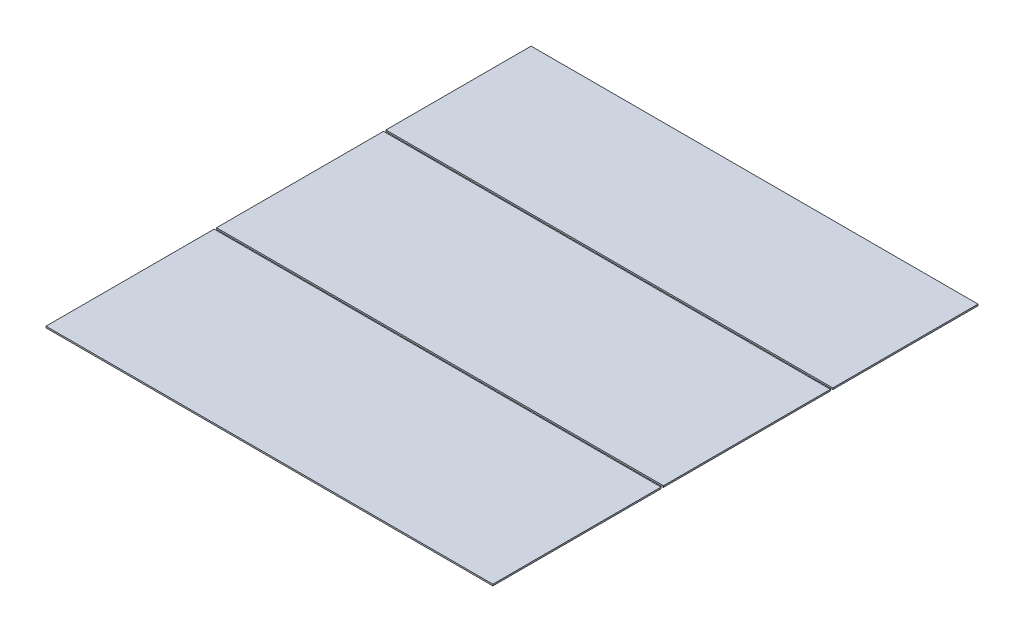
from build123d import *

# Parameters (mm, degrees)
BOSS_EXTRUDE1_DEPTH             = 2.5
BOSS_EXTRUDE1_DEPTH_BACK        = 2.5
SKETCH1_W                       = 1473.2
SKETCH1_H                       = 470.568
BOSS_EXTRUDE1_2_DEPTH           = 2.5
BOSS_EXTRUDE1_2_DEPTH_BACK      = 2.5
SKETCH1_H_2                     = 546.768
BOSS_EXTRUDE1_3_DEPTH           = 2.5
BOSS_EXTRUDE1_3_DEPTH_BACK      = 2.5
SKETCH1_H_3                     = 542.864
BOSS_EXTRUDE2_REACH             = 1089.541
SKETCH2_W                       = 1485.2
SKETCH2_H                       = 482.568
SKETCH2_W_2                     = 1473.2
SKETCH2_H_2                     = 470.568
SKETCH2_H_3                     = 558.768
SKETCH2_H_4                     = 546.768
SKETCH2_H_5                     = 554.864
SKETCH2_H_6                     = 542.864
BOSS_EXTRUDE2_DIRECTION_2_REACH = 1089.541


with BuildPart() as part:
    # Sketch1 → Boss-Extrude1 (new, two sides: drawn at the far end of the back side and taken through both)
    with BuildSketch(Plane(origin=(0, 0, 0), x_dir=(1, 0, 0), z_dir=(0, 1, 0)).offset(-BOSS_EXTRUDE1_DEPTH_BACK)):
        with Locations((0, 564.816)):
            Rectangle(SKETCH1_W, SKETCH1_H)
    extrude(amount=BOSS_EXTRUDE1_DEPTH + BOSS_EXTRUDE1_DEPTH_BACK)

    # Boss-Extrude2: up to this face of the body (flat: up to its plane)
    boss_extrude2_end = Plane(part.part.faces().sort_by_distance((0, 2.5, -564.816))[0])
    # Sketch2 → Boss-Extrude2 (add, up to the picked face)
    with BuildSketch(Plane(origin=(0, 0, 0), x_dir=(1, 0, 0), z_dir=(0, 1, 0)), mode=Mode.PRIVATE) as boss_extrude2_sk1:
        with Locations((0, 564.816)):
            Rectangle(SKETCH2_W, SKETCH2_H)
        with Locations((0, 564.816)):
            Rectangle(SKETCH2_W_2, SKETCH2_H_2, mode=Mode.SUBTRACT)
    boss_extrude2_tool1 = split(extrude(boss_extrude2_sk1.sketch, amount=BOSS_EXTRUDE2_REACH, mode=Mode.PRIVATE), bisect_by=boss_extrude2_end, keep=Keep.BOTH, mode=Mode.PRIVATE)
    # Sketch2 → Boss-Extrude2 (add, up to the picked face)
    with BuildSketch(Plane(origin=(0, 0, 0), x_dir=(1, 0, 0), z_dir=(0, 1, 0)), mode=Mode.PRIVATE) as boss_extrude2_sk2:
        with Locations((0, -526.716)):
            Rectangle(SKETCH2_W, SKETCH2_H_3)
        with Locations((0, -526.716)):
            Rectangle(SKETCH2_W_2, SKETCH2_H_4, mode=Mode.SUBTRACT)
    boss_extrude2_tool2 = split(extrude(boss_extrude2_sk2.sketch, amount=BOSS_EXTRUDE2_REACH, mode=Mode.PRIVATE), bisect_by=boss_extrude2_end, keep=Keep.BOTH, mode=Mode.PRIVATE)
    # Sketch2 → Boss-Extrude2 (add, up to the picked face)
    with BuildSketch(Plane(origin=(0, 0, 0), x_dir=(1, 0, 0), z_dir=(0, 1, 0)), mode=Mode.PRIVATE) as boss_extrude2_sk3:
        with Locations((0, 38.1)):
            Rectangle(SKETCH2_W, SKETCH2_H_5)
        with Locations((0, 38.1)):
            Rectangle(SKETCH2_W_2, SKETCH2_H_6, mode=Mode.SUBTRACT)
    boss_extrude2_tool3 = split(extrude(boss_extrude2_sk3.sketch, amount=BOSS_EXTRUDE2_REACH, mode=Mode.PRIVATE), bisect_by=boss_extrude2_end, keep=Keep.BOTH, mode=Mode.PRIVATE)


with BuildPart() as body_2:
    # Sketch1 → Boss-Extrude1 2 (new, two sides: drawn at the far end of the back side and taken through both)
    with BuildSketch(Plane(origin=(0, 0, 0), x_dir=(1, 0, 0), z_dir=(0, 1, 0)).offset(-BOSS_EXTRUDE1_2_DEPTH_BACK)):
        with Locations((0, -526.716)):
            Rectangle(SKETCH1_W, SKETCH1_H_2)
    extrude(amount=BOSS_EXTRUDE1_2_DEPTH + BOSS_EXTRUDE1_2_DEPTH_BACK)


with BuildPart() as body_3:
    # Sketch1 → Boss-Extrude1 3 (new, two sides: drawn at the far end of the back side and taken through both)
    with BuildSketch(Plane(origin=(0, 0, 0), x_dir=(1, 0, 0), z_dir=(0, 1, 0)).offset(-BOSS_EXTRUDE1_3_DEPTH_BACK)):
        with Locations((0, 38.1)):
            Rectangle(SKETCH1_W, SKETCH1_H_3)
    extrude(amount=BOSS_EXTRUDE1_3_DEPTH + BOSS_EXTRUDE1_3_DEPTH_BACK)


with BuildPart() as part_1:
    add(part.part)

    add(body_2.part)  # Boss-Extrude2 merges body 2

    add(body_3.part)  # Boss-Extrude2 merges body 3
    add(boss_extrude2_tool1.solids().sort_by(Axis((0, 0, -804.538369), (0, 1, 0)))[0])
    add(boss_extrude2_tool2.solids().sort_by(Axis((0, 0, 804.513166), (0, 1, 0)))[0])
    add(boss_extrude2_tool3.solids().sort_by(Axis((0, 0, -313.946537), (0, 1, 0)))[0])

    # Boss-Extrude2 direction 2: up to this face of the body (flat: up to its plane)
    boss_extrude2_direction_2_end = Plane(part_1.part.faces().sort_by_distance((0, -2.5, -564.816))[0])
    # Sketch2 → Boss-Extrude2 direction 2 (add, up to the picked face)
    with BuildSketch(Plane(origin=(0, 0, 0), x_dir=(1, 0, 0), z_dir=(0, 1, 0)), mode=Mode.PRIVATE) as boss_extrude2_direction_2_sk1:
        with Locations((0, 564.816)):
            Rectangle(SKETCH2_W, SKETCH2_H)
        with Locations((0, 564.816)):
            Rectangle(SKETCH2_W_2, SKETCH2_H_2, mode=Mode.SUBTRACT)
    boss_extrude2_direction_2_tool1 = split(extrude(boss_extrude2_direction_2_sk1.sketch, amount=-BOSS_EXTRUDE2_DIRECTION_2_REACH, mode=Mode.PRIVATE), bisect_by=boss_extrude2_direction_2_end, keep=Keep.BOTH, mode=Mode.PRIVATE)
    # Sketch2 → Boss-Extrude2 direction 2 (add, up to the picked face)
    with BuildSketch(Plane(origin=(0, 0, 0), x_dir=(1, 0, 0), z_dir=(0, 1, 0)), mode=Mode.PRIVATE) as boss_extrude2_direction_2_sk2:
        with Locations((0, -526.716)):
            Rectangle(SKETCH2_W, SKETCH2_H_3)
        with Locations((0, -526.716)):
            Rectangle(SKETCH2_W_2, SKETCH2_H_4, mode=Mode.SUBTRACT)
    boss_extrude2_direction_2_tool2 = split(extrude(boss_extrude2_direction_2_sk2.sketch, amount=-BOSS_EXTRUDE2_DIRECTION_2_REACH, mode=Mode.PRIVATE), bisect_by=boss_extrude2_direction_2_end, keep=Keep.BOTH, mode=Mode.PRIVATE)
    # Sketch2 → Boss-Extrude2 direction 2 (add, up to the picked face)
    with BuildSketch(Plane(origin=(0, 0, 0), x_dir=(1, 0, 0), z_dir=(0, 1, 0)), mode=Mode.PRIVATE) as boss_extrude2_direction_2_sk3:
        with Locations((0, 38.1)):
            Rectangle(SKETCH2_W, SKETCH2_H_5)
        with Locations((0, 38.1)):
            Rectangle(SKETCH2_W_2, SKETCH2_H_6, mode=Mode.SUBTRACT)
    boss_extrude2_direction_2_tool3 = split(extrude(boss_extrude2_direction_2_sk3.sketch, amount=-BOSS_EXTRUDE2_DIRECTION_2_REACH, mode=Mode.PRIVATE), bisect_by=boss_extrude2_direction_2_end, keep=Keep.BOTH, mode=Mode.PRIVATE)
    add(boss_extrude2_direction_2_tool1.solids().sort_by(Axis((0, 0, -804.538369), (0, -1, 0)))[0])
    add(boss_extrude2_direction_2_tool2.solids().sort_by(Axis((0, 0, 804.513166), (0, -1, 0)))[0])
    add(boss_extrude2_direction_2_tool3.solids().sort_by(Axis((0, 0, -313.946537), (0, -1, 0)))[0])


solid = part_1.part
